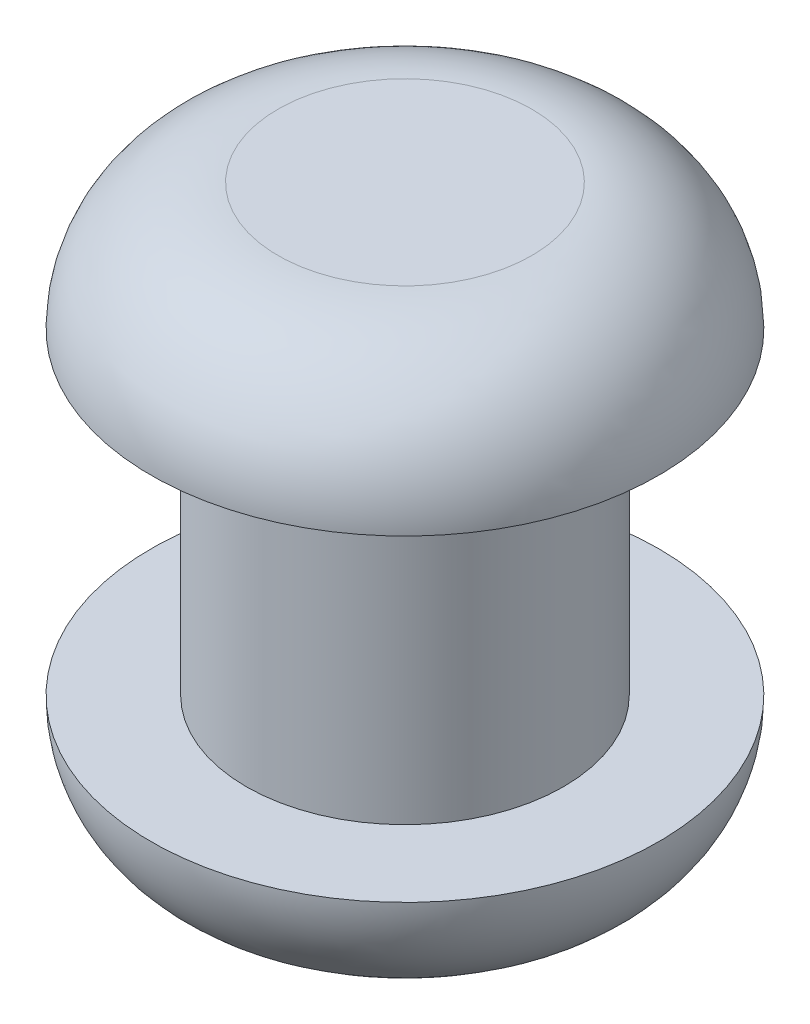
from build123d import *


with BuildPart() as part:
    # Sketch2 → Revolve1 (revolve)
    with BuildSketch(Plane.YZ, mode=Mode.PRIVATE) as revolve1_sk:
        with BuildLine():
            Line((-2.5, 2.5), (2.5, 2.5))
            Line((2.5, 2.5), (2.5, 4))
            ThreePointArc((2.5, 4), (3.914213562, 3.414213562), (4.5, 2))
            Line((4.5, 2), (4.5, 0))
            Line((4.5, 0), (-4.5, 0))
            Line((-4.5, 0), (-4.5, 2))
            ThreePointArc((-4.5, 2), (-3.914213562, 3.414213562), (-2.5, 4))
            Line((-2.5, 4), (-2.5, 2.5))
        make_face()
    revolve(revolve1_sk.sketch.rotate(Axis((0, -8.546595011, 0), (0, 1, 0)), 180), axis=Axis((0, -8.546595011, 0), (0, 1, 0)))


solid = part.part
